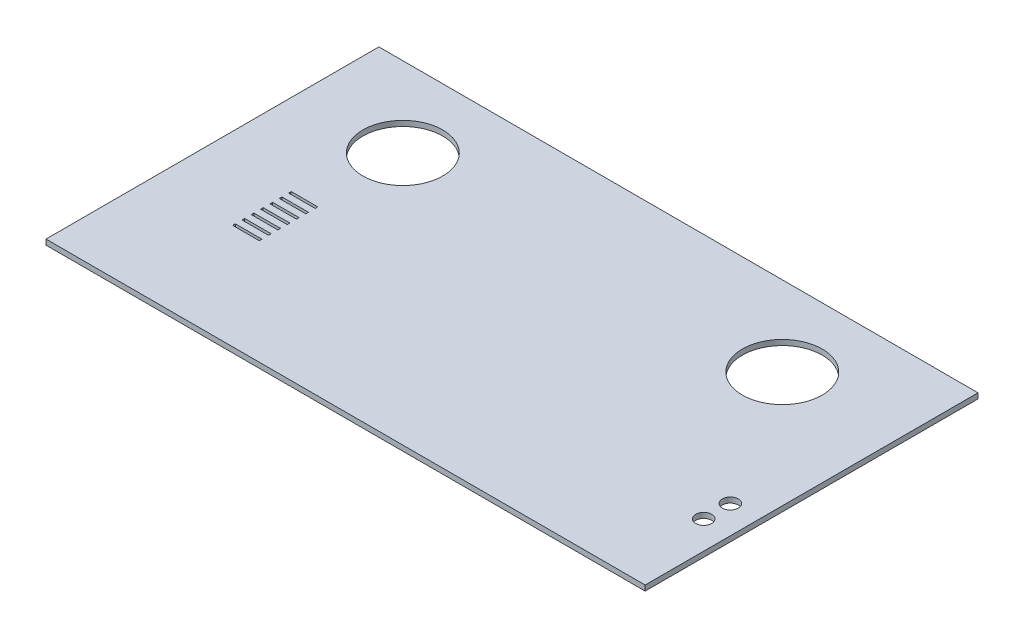
from build123d import *

# Parameters (mm, degrees)
SKETCH_1_W          = 450
SKETCH_1_H          = 250
EXTRUDE_1_DEPTH     = 4
SKETCH_2_R          = 30
CUT_EXTRUDE_1_DEPTH = 515.797047389
SKETCH_3_R          = 6
SKETCH_3_W          = 20
SKETCH_3_H          = 2
CUT_EXTRUDE_2_DEPTH = 515.797047389


with BuildPart() as part:
    # 草圖1 → 填料-伸長1 (new body)
    with BuildSketch(Plane(origin=(0, 0, 0), x_dir=(1, 0, 0), z_dir=(0, 1, 0))):
        with Locations((225, 125)):
            Rectangle(SKETCH_1_W, SKETCH_1_H)
    extrude(amount=EXTRUDE_1_DEPTH)

    # 草圖2 → 除料-伸長1 (cut, through all)
    with BuildSketch(Plane(origin=(0, 4, 0), x_dir=(1, 0, 0), z_dir=(0, 1, 0))):
        with Locations(Location((78, 190, 0), (0, 0, 270))):
            Circle(SKETCH_2_R)
        with Locations(Location((363, 190, 0), (0, 0, 270))):
            Circle(SKETCH_2_R)
    extrude(amount=-CUT_EXTRUDE_1_DEPTH, mode=Mode.SUBTRACT)

    # 草圖3 → 除料-伸長2 (cut, through all)
    with BuildSketch(Plane(origin=(0, 4, 0), x_dir=(1, 0, 0), z_dir=(0, 1, 0))):
        with Locations(Location((429, 85, 0), (0, 0, 270))):
            Circle(SKETCH_3_R)
        with Locations(Location((429, 65, 0), (0, 0, 270))):
            Circle(SKETCH_3_R)
        with Locations((71.17, 122)):
            Rectangle(SKETCH_3_W, SKETCH_3_H)
        with Locations((71.17, 101)):
            Rectangle(SKETCH_3_W, SKETCH_3_H)
        with Locations((71.17, 115)):
            Rectangle(SKETCH_3_W, SKETCH_3_H)
        with Locations((71.17, 108)):
            Rectangle(SKETCH_3_W, SKETCH_3_H)
        with Locations((71.17, 94)):
            Rectangle(SKETCH_3_W, SKETCH_3_H)
        with Locations((71.17, 87)):
            Rectangle(SKETCH_3_W, SKETCH_3_H)
        with Locations((71.17, 80)):
            Rectangle(SKETCH_3_W, SKETCH_3_H)
    extrude(amount=-CUT_EXTRUDE_2_DEPTH, mode=Mode.SUBTRACT)


solid = part.part
